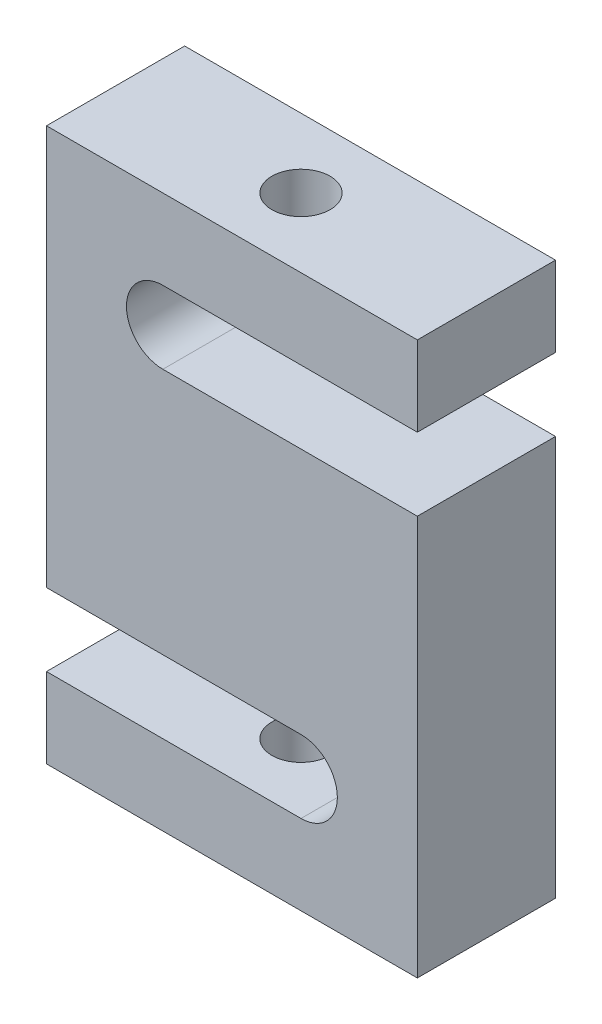
from build123d import *

# Parameters (mm, degrees)
SKETCH_1_W          = 51
SKETCH_1_H          = 76
EXTRUDE_1_DEPTH     = 19
CUT_EXTRUDE_2_DEPTH = 50.550479312
SKETCH_2_R          = 4
CUT_EXTRUDE_1_DEPTH = 19


with BuildPart() as part:
    # 草图1 → 凸台-拉伸1 (new body)
    with BuildSketch(Plane.XY):
        Rectangle(SKETCH_1_W, SKETCH_1_H)
    extrude(amount=EXTRUDE_1_DEPTH)

    # 草图3 → 切除-拉伸2 (cut, through all)
    with BuildSketch(Plane(origin=(0, 0, 0), x_dir=(-1, 0, 0), z_dir=(0, 0, -1))):
        with BuildLine():
            Line((-25.5, 27), (9.5, 27))
            ThreePointArc((9.5, 27), (14.5, 22), (9.5, 17))
            Line((9.5, 17), (-25.5, 17))
            Line((-25.5, 17), (-25.5, 27))
        make_face()
        with BuildLine():
            Line((25.5, -27), (-9.5, -27))
            ThreePointArc((-9.5, -27), (-14.5, -22), (-9.5, -17))
            Line((-9.5, -17), (25.5, -17))
            Line((25.5, -17), (25.5, -27))
        make_face()
    extrude(amount=-CUT_EXTRUDE_2_DEPTH, mode=Mode.SUBTRACT)

    # 草图2 → 切除-拉伸1 (cut)
    with BuildSketch(Plane(origin=(0, 38, 0), x_dir=(1, 0, 0), z_dir=(0, 1, 0))):
        with Locations(Location((0, -9.5, 0), (0, 0, 270))):
            Circle(SKETCH_2_R)
    cut_extrude_1 = extrude(amount=-CUT_EXTRUDE_1_DEPTH, mode=Mode.SUBTRACT)

    # 镜向1: 切除-拉伸1 across plane
    add(cut_extrude_1.mirror(Plane.ZX), mode=Mode.SUBTRACT)


solid = part.part
